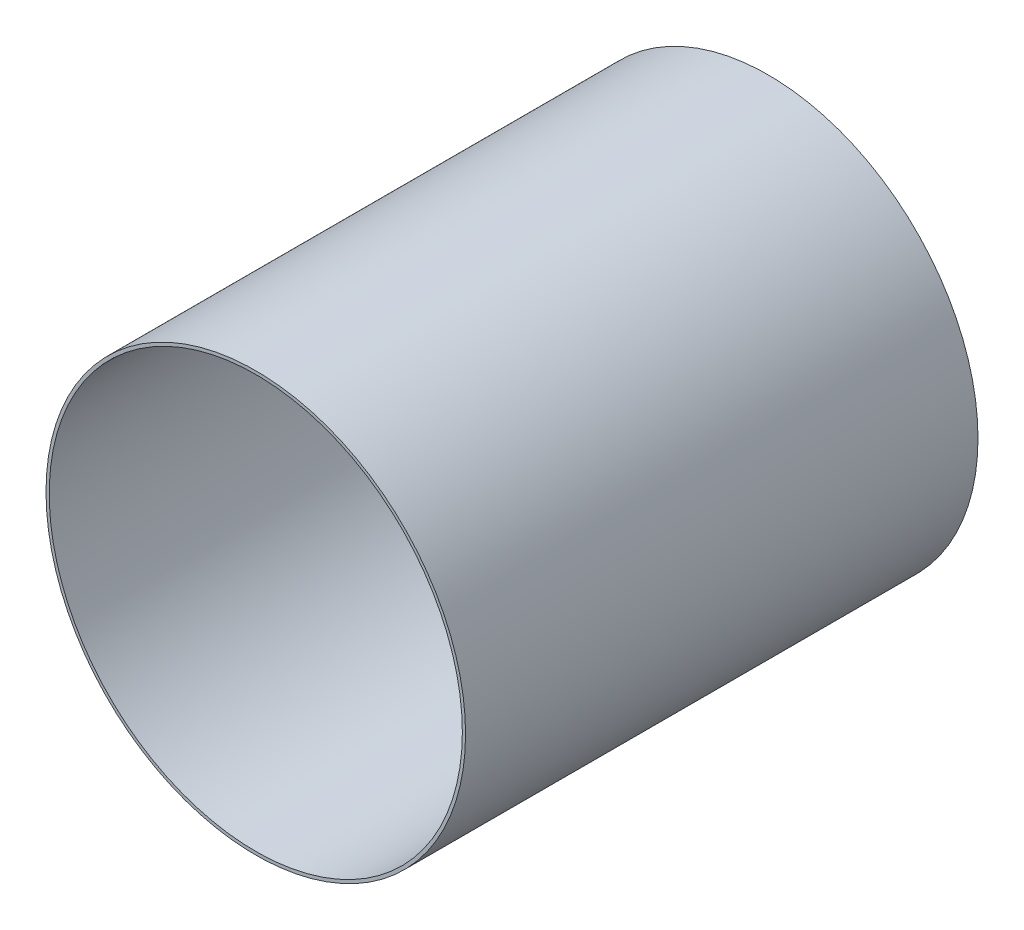
from build123d import *

# Parameters (mm, degrees)
ESBO_O1_R                = 13.1
ESBO_O1_R_2              = 12.9
RESSALTO_EXTRUS_O2_DEPTH = 31
RESSALTO_EXTRUS_O3_START = 1
ESBO_O2_R                = 13.1
RESSALTO_EXTRUS_O3_DEPTH = 1


with BuildPart() as part:
    # Esboço1 → Ressalto-extrusão2 (new body)
    with BuildSketch(Plane.XY):
        Circle(ESBO_O1_R)
        Circle(ESBO_O1_R_2, mode=Mode.SUBTRACT)
    extrude(amount=RESSALTO_EXTRUS_O2_DEPTH)

    # Esboço2 → Ressalto-extrusão3 (add)
    with BuildSketch(Plane(origin=(0, 0, 0), x_dir=(-1, 0, 0), z_dir=(0, 0, -1)).offset(RESSALTO_EXTRUS_O3_START)):
        Circle(ESBO_O2_R)
    extrude(amount=-RESSALTO_EXTRUS_O3_DEPTH)


solid = part.part
